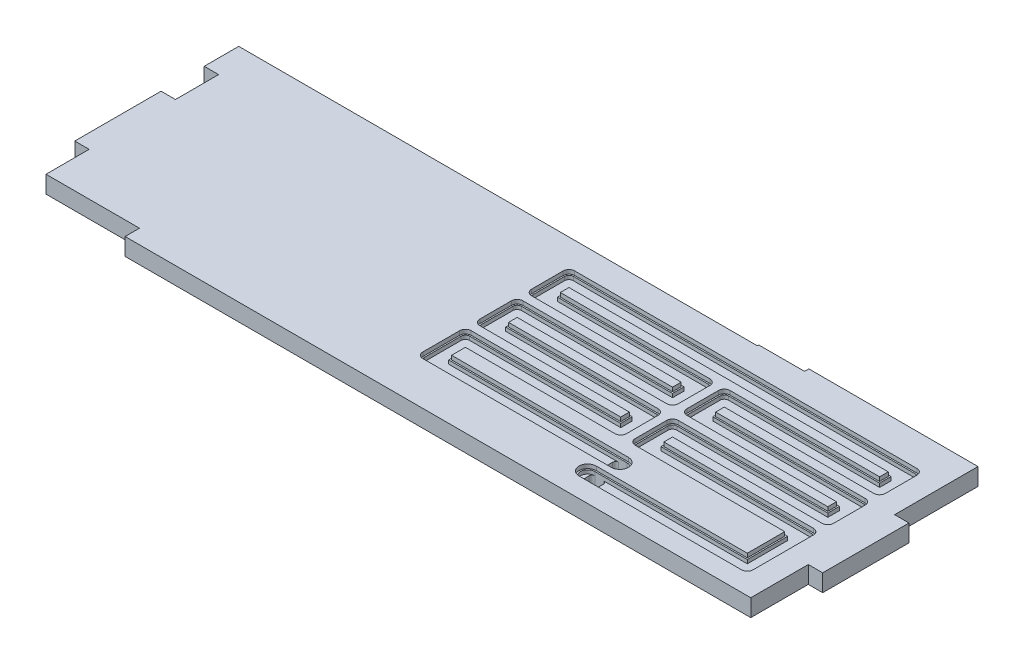
from build123d import *

# Parameters (mm, degrees)
EXTRUDE_1_DEPTH     = 60
CUT_EXTRUDE_2_DEPTH = 27
CUT_EXTRUDE_3_DEPTH = 14
CUT_EXTRUDE_4_DEPTH = 55
CUT_EXTRUDE_5_DEPTH = 60
CUT_EXTRUDE_6_DEPTH = 60
CUT_EXTRUDE_7_DEPTH = 55
CUT_EXTRUDE_8_DEPTH = 55


with BuildPart() as part:
    # 草图1 → 凸台-拉伸1 (new body)
    with BuildSketch(Plane(origin=(0, 0, 0), x_dir=(1, 0, 0), z_dir=(0, 1, 0))):
        Polygon((0, 0), (1803, 0), (1803, 5), (1962, 5), (1962, 20), (2550, 20), (2550, -270), (2600, -270), (2600, -570), (2550, -570), (2550, -770), (375, -770), (375, -720), (50, -720), (50, -570), (0, -570), (0, -270), (50, -270), (50, -120), (0, -120), align=None)
    extrude(amount=-EXTRUDE_1_DEPTH)

    # 草图1<4> → 切除-拉伸2 (cut)
    with BuildSketch(Plane(origin=(0, 0, 0), x_dir=(1, 0, 0), z_dir=(0, 1, 0))):
        with BuildLine():
            Line((1885, -697), (2450, -697))
            ThreePointArc((2450, -697), (2460.606601718, -692.606601718), (2465, -682))
            Line((2465, -682), (2465, -472))
            ThreePointArc((2465, -472), (2460.606601718, -461.393398282), (2450, -457))
            Line((2450, -457), (1925, -457))
            Line((1925, -457), (1925, -417))
            Line((1925, -417), (2450, -417))
            ThreePointArc((2450, -417), (2460.606601718, -412.606601718), (2465, -402))
            Line((2465, -402), (2465, -292))
            ThreePointArc((2465, -292), (2460.606601718, -281.393398282), (2450, -277))
            Line((2450, -277), (1925, -277))
            Line((1925, -277), (1925, -237))
            Line((1925, -237), (2450, -237))
            ThreePointArc((2450, -237), (2460.606601718, -232.606601718), (2465, -222))
            Line((2465, -222), (2465, -112))
            ThreePointArc((2465, -112), (2460.606601718, -101.393398282), (2450, -97))
            Line((2450, -97), (1260, -97))
            ThreePointArc((1260, -97), (1249.393398282, -101.393398282), (1245, -112))
            Line((1245, -112), (1245, -222))
            ThreePointArc((1245, -222), (1249.393398282, -232.606601718), (1260, -237))
            Line((1260, -237), (1785, -237))
            Line((1785, -237), (1785, -277))
            Line((1785, -277), (1260, -277))
            ThreePointArc((1260, -277), (1249.393398282, -281.393398282), (1245, -292))
            Line((1245, -292), (1245, -402))
            ThreePointArc((1245, -402), (1249.393398282, -412.606601718), (1260, -417))
            Line((1260, -417), (1785, -417))
            Line((1785, -417), (1785, -457))
            Line((1785, -457), (1260, -457))
            ThreePointArc((1260, -457), (1249.393398282, -461.393398282), (1245, -472))
            Line((1245, -472), (1245, -600))
            ThreePointArc((1245, -600), (1249.393398282, -610.606601718), (1260, -615))
            Line((1260, -615), (1915, -615))
            ThreePointArc((1915, -615), (1940, -590), (1915, -565))
            Line((1915, -565), (1295, -565))
            Line((1295, -565), (1295, -507))
            Line((1295, -507), (1820, -507))
            ThreePointArc((1820, -507), (1830.606601718, -502.606601718), (1835, -492))
            Line((1835, -492), (1835, -382))
            ThreePointArc((1835, -382), (1830.606601718, -371.393398282), (1820, -367))
            Line((1820, -367), (1295, -367))
            Line((1295, -367), (1295, -327))
            Line((1295, -327), (1820, -327))
            ThreePointArc((1820, -327), (1830.606601718, -322.606601718), (1835, -312))
            Line((1835, -312), (1835, -202))
            ThreePointArc((1835, -202), (1830.606601718, -191.393398282), (1820, -187))
            Line((1820, -187), (1295, -187))
            Line((1295, -187), (1295, -147))
            Line((1295, -147), (2415, -147))
            Line((2415, -147), (2415, -187))
            Line((2415, -187), (1890, -187))
            ThreePointArc((1890, -187), (1879.393398282, -191.393398282), (1875, -202))
            Line((1875, -202), (1875, -312))
            ThreePointArc((1875, -312), (1879.393398282, -322.606601718), (1890, -327))
            Line((1890, -327), (2415, -327))
            Line((2415, -327), (2415, -367))
            Line((2415, -367), (1890, -367))
            ThreePointArc((1890, -367), (1879.393398282, -371.393398282), (1875, -382))
            Line((1875, -382), (1875, -492))
            ThreePointArc((1875, -492), (1879.393398282, -502.606601718), (1890, -507))
            Line((1890, -507), (2415, -507))
            Line((2415, -507), (2415, -647))
            Line((2415, -647), (1885, -647))
            ThreePointArc((1885, -647), (1860, -672), (1885, -697))
        make_face()
    extrude(amount=-CUT_EXTRUDE_2_DEPTH, mode=Mode.SUBTRACT)

    # 草图1<5> → 切除-拉伸3 (cut)
    with BuildSketch(Plane(origin=(0, 0, 0), x_dir=(1, 0, 0), z_dir=(0, 1, 0))):
        with BuildLine():
            Line((1885, -702), (2450, -702))
            ThreePointArc((2450, -702), (2464.142135624, -696.142135624), (2470, -682))
            Line((2470, -682), (2470, -472))
            ThreePointArc((2470, -472), (2464.142135624, -457.857864376), (2450, -452))
            Line((2450, -452), (1930, -452))
            Line((1930, -452), (1930, -422))
            Line((1930, -422), (2450, -422))
            ThreePointArc((2450, -422), (2464.142135624, -416.142135624), (2470, -402))
            Line((2470, -402), (2470, -292))
            ThreePointArc((2470, -292), (2464.142135624, -277.857864376), (2450, -272))
            Line((2450, -272), (1930, -272))
            Line((1930, -272), (1930, -242))
            Line((1930, -242), (2450, -242))
            ThreePointArc((2450, -242), (2464.142135624, -236.142135624), (2470, -222))
            Line((2470, -222), (2470, -112))
            ThreePointArc((2470, -112), (2464.142135624, -97.857864376), (2450, -92))
            Line((2450, -92), (1260, -92))
            ThreePointArc((1260, -92), (1245.857864376, -97.857864376), (1240, -112))
            Line((1240, -112), (1240, -222))
            ThreePointArc((1240, -222), (1245.857864376, -236.142135624), (1260, -242))
            Line((1260, -242), (1780, -242))
            Line((1780, -242), (1780, -272))
            Line((1780, -272), (1260, -272))
            ThreePointArc((1260, -272), (1245.857864376, -277.857864376), (1240, -292))
            Line((1240, -292), (1240, -402))
            ThreePointArc((1240, -402), (1245.857864376, -416.142135624), (1260, -422))
            Line((1260, -422), (1780, -422))
            Line((1780, -422), (1780, -452))
            Line((1780, -452), (1260, -452))
            ThreePointArc((1260, -452), (1245.857864376, -457.857864376), (1240, -472))
            Line((1240, -472), (1240, -600))
            ThreePointArc((1240, -600), (1245.857864376, -614.142135624), (1260, -620))
            Line((1260, -620), (1915, -620))
            ThreePointArc((1915, -620), (1945, -590), (1915, -560))
            Line((1915, -560), (1300, -560))
            Line((1300, -560), (1300, -512))
            Line((1300, -512), (1820, -512))
            ThreePointArc((1820, -512), (1834.142135624, -506.142135624), (1840, -492))
            Line((1840, -492), (1840, -382))
            ThreePointArc((1840, -382), (1834.142135624, -367.857864376), (1820, -362))
            Line((1820, -362), (1300, -362))
            Line((1300, -362), (1300, -332))
            Line((1300, -332), (1820, -332))
            ThreePointArc((1820, -332), (1834.142135624, -326.142135624), (1840, -312))
            Line((1840, -312), (1840, -202))
            ThreePointArc((1840, -202), (1834.142135624, -187.857864376), (1820, -182))
            Line((1820, -182), (1300, -182))
            Line((1300, -182), (1300, -152))
            Line((1300, -152), (2410, -152))
            Line((2410, -152), (2410, -182))
            Line((2410, -182), (1890, -182))
            ThreePointArc((1890, -182), (1875.857864376, -187.857864376), (1870, -202))
            Line((1870, -202), (1870, -312))
            ThreePointArc((1870, -312), (1875.857864376, -326.142135624), (1890, -332))
            Line((1890, -332), (2410, -332))
            Line((2410, -332), (2410, -362))
            Line((2410, -362), (1890, -362))
            ThreePointArc((1890, -362), (1875.857864376, -367.857864376), (1870, -382))
            Line((1870, -382), (1870, -492))
            ThreePointArc((1870, -492), (1875.857864376, -506.142135624), (1890, -512))
            Line((1890, -512), (2410, -512))
            Line((2410, -512), (2410, -642))
            Line((2410, -642), (1885, -642))
            ThreePointArc((1885, -642), (1855, -672), (1885, -702))
        make_face()
    extrude(amount=-CUT_EXTRUDE_3_DEPTH, mode=Mode.SUBTRACT)

    # 草图3 → 切除-拉伸4 (cut)
    with BuildSketch(Plane(origin=(0, 0, 0), x_dir=(1, 0, 0), z_dir=(0, 1, 0))):
        with BuildLine():
            Line((1907.5, -689.5), (1892.5, -689.5))
            ThreePointArc((1892.5, -689.5), (1885.428932188, -686.571067812), (1882.5, -679.5))
            Line((1882.5, -679.5), (1882.5, -664.5))
            ThreePointArc((1882.5, -664.5), (1885.428932188, -657.428932188), (1892.5, -654.5))
            Line((1892.5, -654.5), (1907.5, -654.5))
            ThreePointArc((1907.5, -654.5), (1914.571067812, -657.428932188), (1917.5, -664.5))
            Line((1917.5, -664.5), (1917.5, -679.5))
            ThreePointArc((1917.5, -679.5), (1914.571067812, -686.571067812), (1907.5, -689.5))
        make_face()
    extrude(amount=-CUT_EXTRUDE_4_DEPTH, mode=Mode.SUBTRACT)

    # 草图3<3> → 切除-拉伸5 (cut)
    with BuildSketch(Plane(origin=(0, 0, 0), x_dir=(1, 0, 0), z_dir=(0, 1, 0))):
        with BuildLine():
            Line((1907.5, -689.5), (1892.5, -689.5))
            ThreePointArc((1892.5, -689.5), (1885.428932188, -686.571067812), (1882.5, -679.5))
            Line((1882.5, -679.5), (1882.5, -664.5))
            ThreePointArc((1882.5, -664.5), (1885.428932188, -657.428932188), (1892.5, -654.5))
            Line((1892.5, -654.5), (1907.5, -654.5))
            ThreePointArc((1907.5, -654.5), (1914.571067812, -657.428932188), (1917.5, -664.5))
            Line((1917.5, -664.5), (1917.5, -679.5))
            ThreePointArc((1917.5, -679.5), (1914.571067812, -686.571067812), (1907.5, -689.5))
        make_face()
    extrude(amount=-CUT_EXTRUDE_5_DEPTH, mode=Mode.SUBTRACT)

    # 草图1<6> → 切除-拉伸6 (cut)
    with BuildSketch(Plane(origin=(0, 0, 0), x_dir=(1, 0, 0), z_dir=(0, 1, 0))):
        with BuildLine():
            Line((1907.5, -607.5), (1892.5, -607.5))
            ThreePointArc((1892.5, -607.5), (1885.428932188, -604.571067812), (1882.5, -597.5))
            Line((1882.5, -597.5), (1882.5, -582.5))
            ThreePointArc((1882.5, -582.5), (1885.428932188, -575.428932188), (1892.5, -572.5))
            Line((1892.5, -572.5), (1907.5, -572.5))
            ThreePointArc((1907.5, -572.5), (1914.571067812, -575.428932188), (1917.5, -582.5))
            Line((1917.5, -582.5), (1917.5, -597.5))
            ThreePointArc((1917.5, -597.5), (1914.571067812, -604.571067812), (1907.5, -607.5))
        make_face()
    extrude(amount=-CUT_EXTRUDE_6_DEPTH, mode=Mode.SUBTRACT)

    # 草图1<7> → 切除-拉伸7 (cut)
    with BuildSketch(Plane(origin=(0, 0, 0), x_dir=(1, 0, 0), z_dir=(0, 1, 0))):
        with BuildLine():
            Line((1915, -615), (1885, -615))
            ThreePointArc((1885, -615), (1877.928932188, -612.071067812), (1875, -605))
            Line((1875, -605), (1875, -575))
            ThreePointArc((1875, -575), (1877.928932188, -567.928932188), (1885, -565))
            Line((1885, -565), (1915, -565))
            ThreePointArc((1915, -565), (1922.071067812, -567.928932188), (1925, -575))
            Line((1925, -575), (1925, -605))
            ThreePointArc((1925, -605), (1922.071067812, -612.071067812), (1915, -615))
        make_face()
    extrude(amount=-CUT_EXTRUDE_7_DEPTH, mode=Mode.SUBTRACT)

    # 草图3<4> → 切除-拉伸8 (cut)
    with BuildSketch(Plane(origin=(0, 0, 0), x_dir=(1, 0, 0), z_dir=(0, 1, 0))):
        with BuildLine():
            Line((1915, -697), (1885, -697))
            ThreePointArc((1885, -697), (1877.928932188, -694.071067812), (1875, -687))
            Line((1875, -687), (1875, -657))
            ThreePointArc((1875, -657), (1877.928932188, -649.928932188), (1885, -647))
            Line((1885, -647), (1915, -647))
            ThreePointArc((1915, -647), (1922.071067812, -649.928932188), (1925, -657))
            Line((1925, -657), (1925, -687))
            ThreePointArc((1925, -687), (1922.071067812, -694.071067812), (1915, -697))
        make_face()
    extrude(amount=-CUT_EXTRUDE_8_DEPTH, mode=Mode.SUBTRACT)


solid = part.part
